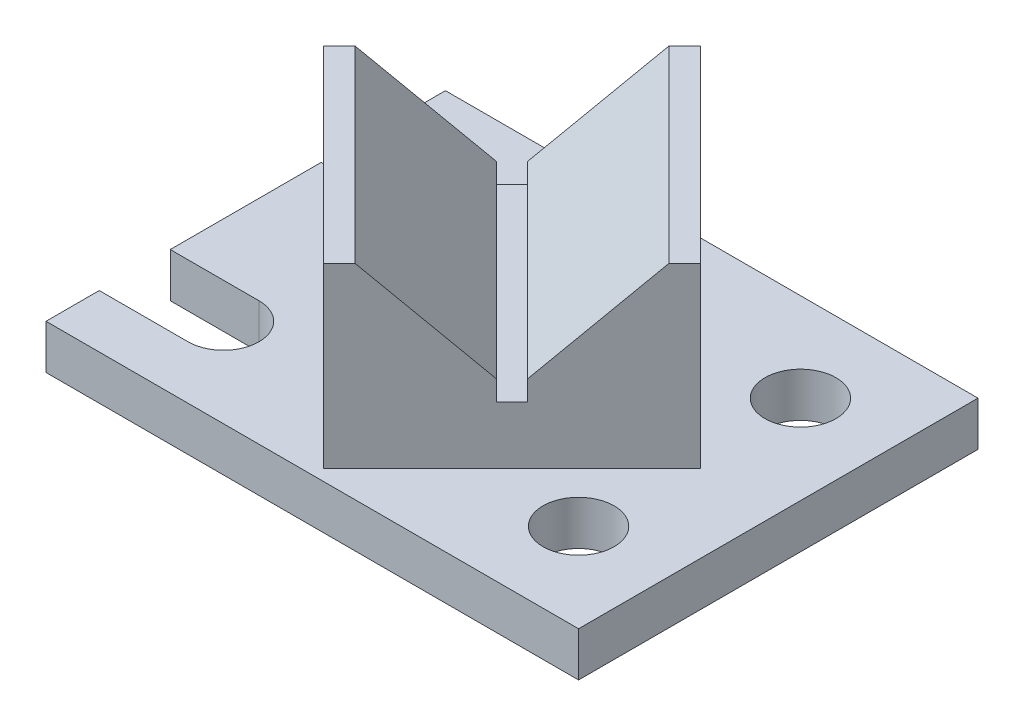
from build123d import *

# Parameters (mm, degrees)
CROQUIS1_W              = 152.4
CROQUIS1_H              = 114.3
SALIENTE_EXTRUIR1_DEPTH = 12.7
CROQUIS3_R              = 10.16
CORTAR_EXTRUIR1_DEPTH   = 97.092936785
SALIENTE_EXTRUIR2_DEPTH = 50.8
CORTAR_EXTRUIR2_DEPTH   = 148.45007773


with BuildPart() as part:
    # Croquis1 → Saliente-Extruir1 (new body)
    with BuildSketch(Plane(origin=(0, 0, 0), x_dir=(1, 0, 0), z_dir=(0, 1, 0))):
        Rectangle(CROQUIS1_W, CROQUIS1_H)
    extrude(amount=SALIENTE_EXTRUIR1_DEPTH)

    # Croquis3 → Cortar-Extruir1 (cut, through all)
    with BuildSketch(Plane(origin=(0, 12.7, 0), x_dir=(1, 0, 0), z_dir=(0, 1, 0))):
        with Locations(Location((50.8, -31.75, 0), (0, 0, 270))):
            Circle(CROQUIS3_R)
        with BuildLine():
            Line((-76.2, -21.59), (-50.8, -21.59))
            ThreePointArc((-50.8, -21.59), (-40.64, -31.75), (-50.8, -41.91))
            Line((-50.8, -41.91), (-76.2, -41.91))
            Line((-76.2, -41.91), (-76.2, -21.59))
        make_face()
    cortar_extruir1 = extrude(amount=-CORTAR_EXTRUIR1_DEPTH, mode=Mode.SUBTRACT)

    # Simetría1: Cortar-Extruir1 across plane
    add(cortar_extruir1.mirror(Plane.XY), mode=Mode.SUBTRACT)

    # Croquis4 → Saliente-Extruir2 (add)
    with BuildSketch(Plane(origin=(0, 12.7, 0), x_dir=(1, 0, 0), z_dir=(0, 1, 0))):
        Polygon((53.881536726, 0), (0, -53.881536726), (-53.881536726, 0), (0, 53.881536726), align=None)
    extrude(amount=SALIENTE_EXTRUIR2_DEPTH)

    # Croquis5 → Cortar-Extruir2 (cut, through all)
    with BuildSketch(Plane(origin=(26.940768363, 0, 26.940768363), x_dir=(0.7071067811865464, 0, -0.7071067811865488), z_dir=(0.7071067811865488, 0, 0.7071067811865464))):
        Polygon((-31.75, 63.5), (31.75, 63.5), (3.175, 34.925), (3.175, 29.21), (-3.175, 29.21), (-3.175, 34.925), align=None)
    extrude(amount=-CORTAR_EXTRUIR2_DEPTH, mode=Mode.SUBTRACT)


solid = part.part
